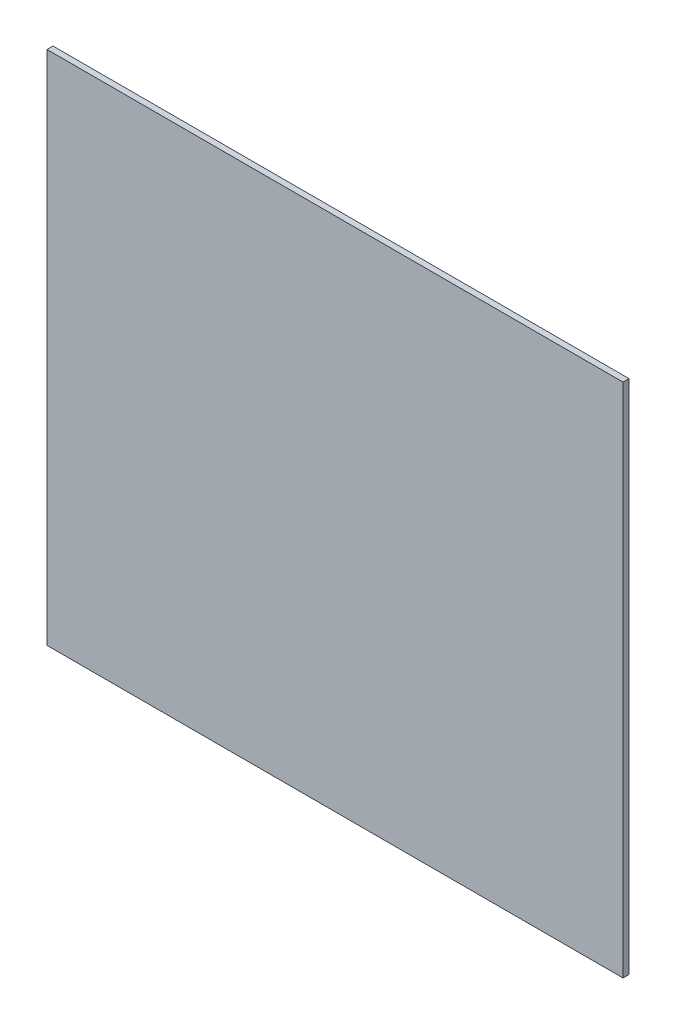
from build123d import *

# Parameters (mm, degrees)
SKETCH1_W           = 2400
SKETCH1_H           = 2150
BOSS_EXTRUDE1_DEPTH = 25


with BuildPart() as part:
    # Sketch1 → Boss-Extrude1 (new body)
    with BuildSketch(Plane.XY):
        Rectangle(SKETCH1_W, SKETCH1_H)
    extrude(amount=BOSS_EXTRUDE1_DEPTH)


solid = part.part
